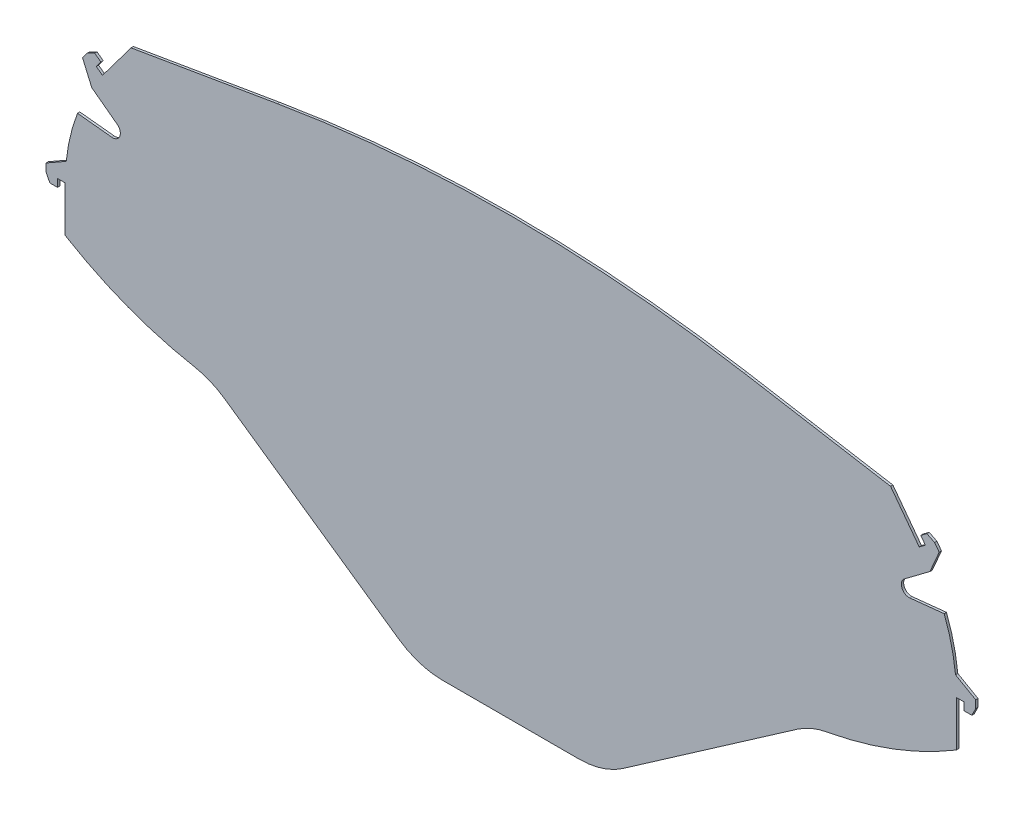
from build123d import *

# Parameters (mm, degrees)
MAIN_SHAPE_DEPTH        = 0.6
TABS_DEPTH              = 154.060061459
TABS_DEPTH_BACK         = 154.060061459
CHIN_GUARD_DEPTH        = 0.6
FILLET1_R               = 20
CUT_EXTRUDE1_DEPTH      = 172.662513141
CUT_EXTRUDE1_DEPTH_BACK = 172.662513141
CUT_EXTRUDE2_DEPTH      = 172.662513141
CUT_EXTRUDE2_DEPTH_BACK = 172.662513141


with BuildPart() as part:
    # Sketch1 → Main Shape (new body)
    with BuildSketch(Plane.XY):
        with BuildLine():
            Line((-24, -91.764766734), (24, -91.764766734))
            Line((24, -91.764766734), (78.266232563, -84.05670244))
            ThreePointArc((78.266232563, -84.05670244), (97.655491519, -79.289252293), (115.711102551, -70.764766734))
            ThreePointArc((115.711102551, -70.764766734), (120.685143325, -65.658407438), (122.5, -58.764766734))
            ThreePointArc((122.5, -58.764766734), (120.227482046, -43.118277124), (113.597722286, -28.764766734))
            ThreePointArc((113.597722286, -28.764766734), (107.811505455, -22.955172168), (100.180351554, -19.955641477))
            Line((100.180351554, -19.955641477), (60.74391922, -13.264766734))
            ThreePointArc((60.74391922, -13.264766734), (50.804108255, -9.246591688), (43.461443341, -1.434367632))
            ThreePointArc((43.461443341, -1.434367632), (36.448172688, 5.805997675), (26.941855461, 9.15842781))
            Line((26.941855461, 9.15842781), (17, 10.235233266))
            Line((17, 10.235233266), (10, 0))
            Line((10, 0), (-10, 0))
            Line((-10, 0), (-17, 10.235233266))
            Line((-17, 10.235233266), (-26.941855461, 9.15842781))
            ThreePointArc((-26.941855461, 9.15842781), (-36.448172688, 5.805997675), (-43.461443341, -1.434367632))
            ThreePointArc((-43.461443341, -1.434367632), (-50.804108255, -9.246591688), (-60.74391922, -13.264766734))
            Line((-60.74391922, -13.264766734), (-100.180351554, -19.955641477))
            ThreePointArc((-100.180351554, -19.955641477), (-107.811505455, -22.955172168), (-113.597722286, -28.764766734))
            ThreePointArc((-113.597722286, -28.764766734), (-120.227482046, -43.118277124), (-122.5, -58.764766734))
            ThreePointArc((-122.5, -58.764766734), (-120.685143325, -65.658407438), (-115.711102551, -70.764766734))
            ThreePointArc((-115.711102551, -70.764766734), (-97.655491519, -79.289252293), (-78.266232563, -84.05670244))
            Line((-78.266232563, -84.05670244), (-24, -91.764766734))
        make_face()
    extrude(amount=MAIN_SHAPE_DEPTH)

    # Sketch2 → Tabs (cut, two sides: drawn at the far end of the back side and taken through both)
    with BuildSketch(Plane.XY.offset(0.6).offset(-TABS_DEPTH_BACK)):
        with BuildLine():
            Line((-121, -58.764766734), (-121, -56.764766734))
            Line((-121, -56.764766734), (-115.742268041, -53.771413729))
            ThreePointArc((-115.742268041, -53.771413729), (-113.511139955, -43.427720083), (-109.089826236, -33.814088314))
            Line((-109.089826236, -33.814088314), (-111.5, -28.264766734))
            Line((-111.5, -28.264766734), (-110.3, -26.664766734))
            Line((-110.3, -26.664766734), (-108.3, -25.664766734))
            Line((-108.3, -25.664766734), (-106.7, -26.864766734))
            Line((-106.7, -26.864766734), (-107.9, -28.464766734))
            Line((-107.9, -28.464766734), (-106.3, -29.664766734))
            Line((-106.3, -29.664766734), (-98.84870892, -19.729711961))
            Line((-98.84870892, -19.729711961), (-100.180351554, -19.955641477))
            ThreePointArc((-100.180351554, -19.955641477), (-107.811505455, -22.955172168), (-113.597722286, -28.764766734))
            ThreePointArc((-113.597722286, -28.764766734), (-120.227482046, -43.118277124), (-122.5, -58.764766734))
            ThreePointArc((-122.5, -58.764766734), (-120.767844146, -65.510135516), (-116, -70.586357152))
            Line((-116, -70.586357152), (-116, -58.764766734))
            Line((-116, -58.764766734), (-118, -58.764766734))
            Line((-118, -58.764766734), (-118, -60.764766734))
            Line((-118, -60.764766734), (-120, -60.764766734))
            Line((-120, -60.764766734), (-121, -58.764766734))
        make_face()
        with BuildLine():
            Line((110.3, -26.664766734), (111.5, -28.264766734))
            Line((111.5, -28.264766734), (109.089826236, -33.814088314))
            ThreePointArc((109.089826236, -33.814088314), (113.511139955, -43.427720083), (115.742268041, -53.771413729))
            Line((115.742268041, -53.771413729), (121, -56.764766734))
            Line((121, -56.764766734), (121, -58.764766734))
            Line((121, -58.764766734), (120, -60.764766734))
            Line((120, -60.764766734), (118, -60.764766734))
            Line((118, -60.764766734), (118, -58.764766734))
            Line((118, -58.764766734), (116, -58.764766734))
            Line((116, -58.764766734), (116, -70.586357152))
            ThreePointArc((116, -70.586357152), (120.767844146, -65.510135516), (122.5, -58.764766734))
            ThreePointArc((122.5, -58.764766734), (120.227482046, -43.118277124), (113.597722286, -28.764766734))
            ThreePointArc((113.597722286, -28.764766734), (107.811505455, -22.955172168), (100.180351554, -19.955641477))
            Line((100.180351554, -19.955641477), (98.84870892, -19.729711961))
            Line((98.84870892, -19.729711961), (106.3, -29.664766734))
            Line((106.3, -29.664766734), (107.9, -28.464766734))
            Line((107.9, -28.464766734), (106.7, -26.864766734))
            Line((106.7, -26.864766734), (108.3, -25.664766734))
            Line((108.3, -25.664766734), (110.3, -26.664766734))
        make_face()
    extrude(amount=TABS_DEPTH + TABS_DEPTH_BACK, mode=Mode.SUBTRACT)

    # Sketch5 → Chin guard (add)
    with BuildSketch(Plane.XY.offset(0.6)):
        Polygon((-78.266232563, -84.05670244), (-24, -121.764766734), (24, -121.764766734), (78.266232563, -84.05670244), (24, -91.764766734), (-24, -91.764766734), align=None)
    extrude(amount=-CHIN_GUARD_DEPTH)

    # Fillet1
    fillet1_edges = [part.edges().sort_by_distance(p)[0] for p in [
        (-24, -121.764766734, 0.3),
        (24, -121.764766734, 0.3),
        (78.266232563, -84.05670244, 0.3),
        (-78.266232563, -84.05670244, 0.3),
    ]]
    fillet(fillet1_edges, radius=FILLET1_R)

    # Sketch6 → Cut-Extrude1 (cut, two sides: drawn at the far end of the back side and taken through both)
    with BuildSketch(Plane.XY.offset(0.6).offset(-CUT_EXTRUDE1_DEPTH_BACK)):
        with BuildLine():
            Line((-60.74391922, -13.264766734), (-60.74391922, 16.735233266))
            Line((-60.74391922, 16.735233266), (60.74391922, 16.735233266))
            Line((60.74391922, 16.735233266), (60.74391922, -13.264766734))
            ThreePointArc((60.74391922, -13.264766734), (0, -8.148349205), (-60.74391922, -13.264766734))
        make_face()
    extrude(amount=CUT_EXTRUDE1_DEPTH + CUT_EXTRUDE1_DEPTH_BACK, mode=Mode.SUBTRACT)

    # Sketch7 → Cut-Extrude2 (cut, two sides: drawn at the far end of the back side and taken through both)
    with BuildSketch(Plane.XY.offset(0.6).offset(-CUT_EXTRUDE2_DEPTH_BACK)):
        with BuildLine():
            Line((-109.089826236, -33.814088314), (-102.449085801, -38.79464364))
            ThreePointArc((-102.449085801, -38.79464364), (-101.786812206, -41.123983791), (-103.854832759, -42.384032539))
            Line((-103.854832759, -42.384032539), (-112.807082802, -41.45817123))
            ThreePointArc((-112.807082802, -41.45817123), (-111.116237814, -37.554538094), (-109.089826236, -33.814088314))
        make_face()
        with BuildLine():
            Line((103.854832759, -42.384032539), (112.807082802, -41.45817123))
            ThreePointArc((112.807082802, -41.45817123), (111.116237814, -37.554538094), (109.089826236, -33.814088314))
            Line((109.089826236, -33.814088314), (102.449085801, -38.79464364))
            ThreePointArc((102.449085801, -38.79464364), (101.786812206, -41.123983791), (103.854832759, -42.384032539))
        make_face()
    extrude(amount=CUT_EXTRUDE2_DEPTH + CUT_EXTRUDE2_DEPTH_BACK, mode=Mode.SUBTRACT)


solid = part.part
